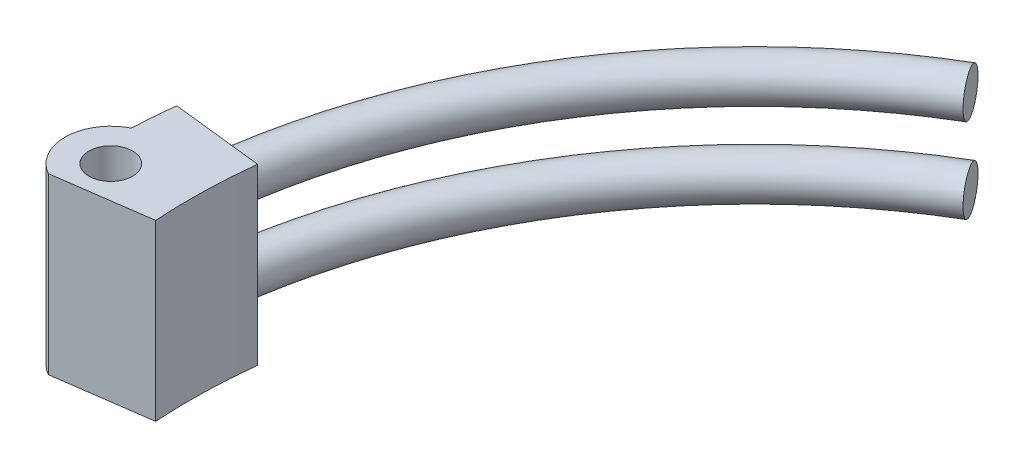
from build123d import *

# Parameters (mm, degrees)
SKETCH2_R           = 1.55
BOSS_EXTRUDE1_DEPTH = 12.35
SKETCH3_R           = 1.5


with BuildPart() as part:
    # Sketch2 → Boss-Extrude1 (new body)
    with BuildSketch(Plane(origin=(0, 0, 0), x_dir=(1, 0, 0), z_dir=(0, 1, 0))):
        with BuildLine():
            ThreePointArc((-39.917771177, -2.56350234), (-39.988230838, 0.970254828), (-39.746472283, 4.496436488))
            Line((-39.746472283, 4.496436488), (-46.205274029, 5.227107417))
            ThreePointArc((-46.205274029, 5.227107417), (-46.34972481, 3.735372816), (-46.44602765, 2.239757921))
            ThreePointArc((-46.44602765, 2.239757921), (-48.2434435, -0.585642563), (-46.591633685, -3.498564803))
            Line((-46.591633685, -3.498564803), (-39.917771177, -2.56350234))
        make_face()
        with Locations(Location((-44.994489261, -0.668082567, 0), (0, 0, 270))):
            Circle(SKETCH2_R, mode=Mode.SUBTRACT)
    extrude(amount=BOSS_EXTRUDE1_DEPTH)

    # Sweep1: sweep along a path in Sketch7
    with BuildLine(Plane(origin=(0, 0, 0), x_dir=(1, 0, 0), z_dir=(0, 1, 0))) as sweep1_path:
        ThreePointArc((-39.746472283, 4.496436488), (-33.564183671, 21.758804529), (-20.329010289, 34.448967193))
    # Sketch3 → Sweep1 (sweep)
    with BuildSketch(Plane(origin=(0, 0, 0), x_dir=(-0.9936618070654342, 0, -0.11241091219030289), z_dir=(0.11241091219030287, 0, -0.993661807065434))):
        with Locations((43.4, 9.175)):
            Circle(SKETCH3_R)
        with Locations((43.4, 3.175)):
            Circle(SKETCH3_R)
    sweep(path=sweep1_path.line)


solid = part.part
